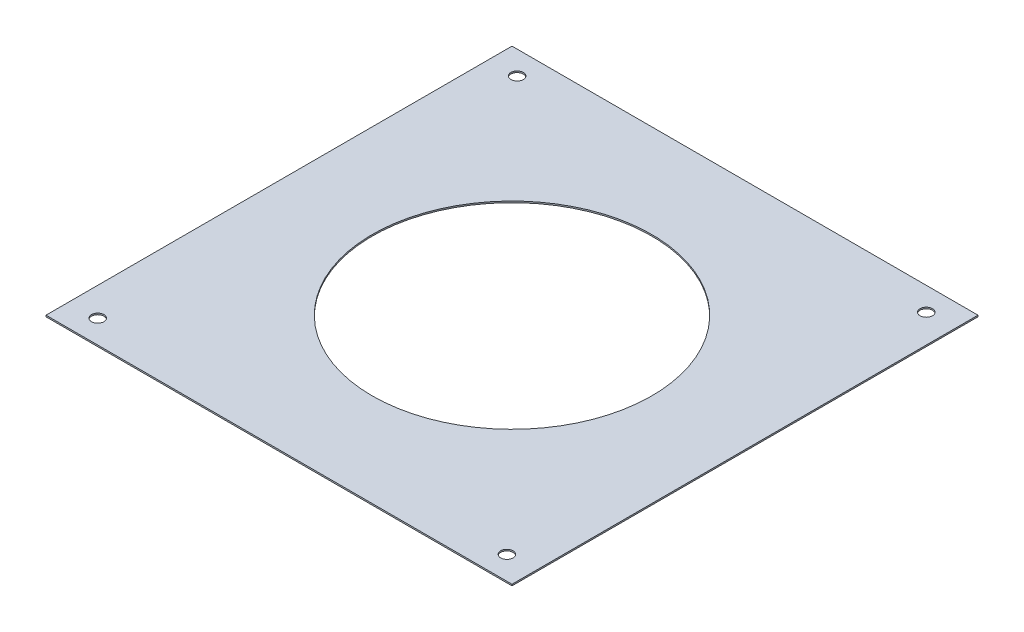
from build123d import *

# Parameters (mm, degrees)
SKETCH1_W           = 254
SKETCH1_H           = 254
SKETCH1_R           = 3.3782
BOSS_EXTRUDE1_DEPTH = 0.79375
SKETCH2_R           = 76.2
CUT_EXTRUDE1_DEPTH  = 0.79375


with BuildPart() as part:
    # Sketch1 → Boss-Extrude1 (new body)
    with BuildSketch(Plane(origin=(0, 0, 0), x_dir=(1, 0, 0), z_dir=(0, 1, 0))):
        Rectangle(SKETCH1_W, SKETCH1_H)
        with Locations(Location((-111.506, 114.3, 0), (0, 0, 270))):
            Circle(SKETCH1_R, mode=Mode.SUBTRACT)
        with Locations(Location((111.506, 114.3, 0), (0, 0, 270))):
            Circle(SKETCH1_R, mode=Mode.SUBTRACT)
        with Locations(Location((111.506, -114.3, 0), (0, 0, 270))):
            Circle(SKETCH1_R, mode=Mode.SUBTRACT)
        with Locations(Location((-111.506, -114.3, 0), (0, 0, 270))):
            Circle(SKETCH1_R, mode=Mode.SUBTRACT)
    extrude(amount=BOSS_EXTRUDE1_DEPTH)

    # Sketch2 → Cut-Extrude1 (cut)
    with BuildSketch(Plane(origin=(0, 0.79375, 0), x_dir=(1, 0, 0), z_dir=(0, 1, 0))):
        with Locations(Location((0, 0, 0), (0, 0, 270))):
            Circle(SKETCH2_R)
    extrude(amount=-CUT_EXTRUDE1_DEPTH, mode=Mode.SUBTRACT)


solid = part.part
